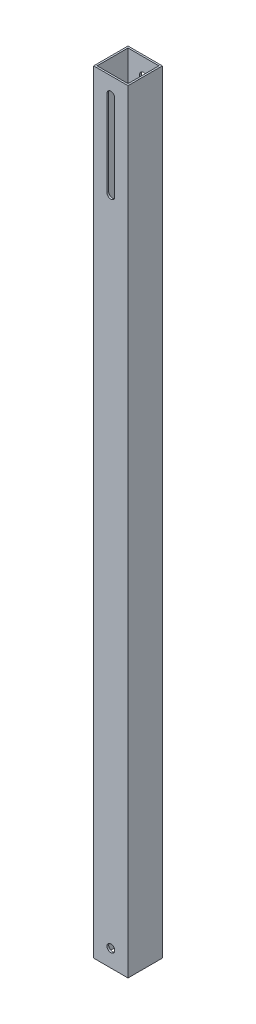
from build123d import *

# Parameters (mm, degrees)
SKETCH1_W           = 20
SKETCH1_H           = 20
SKETCH1_W_2         = 18
SKETCH1_H_2         = 18
BOSS_EXTRUDE1_DEPTH = 450
SKETCH2_R           = 2.25
CUT_EXTRUDE1_DEPTH  = 451.555213043


with BuildPart() as part:
    # Sketch1 → Boss-Extrude1 (new body)
    with BuildSketch(Plane(origin=(0, 0, 0), x_dir=(1, 0, 0), z_dir=(0, 1, 0))):
        Rectangle(SKETCH1_W, SKETCH1_H)
        Rectangle(SKETCH1_W_2, SKETCH1_H_2, mode=Mode.SUBTRACT)
    extrude(amount=BOSS_EXTRUDE1_DEPTH)

    # Sketch2 → Cut-Extrude1 (cut, through all)
    with BuildSketch(Plane.XY.offset(10)):
        with Locations((0, 10)):
            Circle(SKETCH2_R)
        with BuildLine():
            Line((2.25, 440), (2.25, 390))
            ThreePointArc((2.25, 390), (0, 387.75), (-2.25, 390))
            Line((-2.25, 390), (-2.25, 440))
            ThreePointArc((-2.25, 440), (0, 442.25), (2.25, 440))
        make_face()
    extrude(amount=-CUT_EXTRUDE1_DEPTH, mode=Mode.SUBTRACT)


solid = part.part
